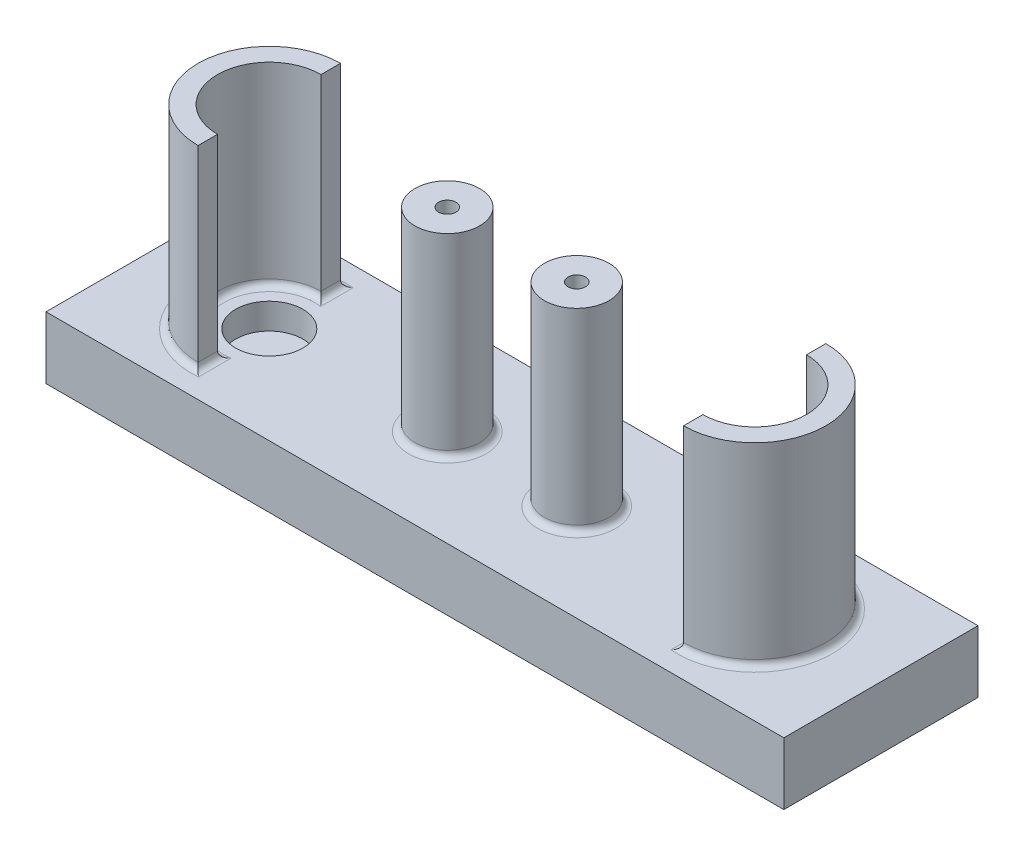
from build123d import *

# Parameters (mm, degrees)
SKETCH1_W           = 144.78
SKETCH1_H           = 38.1
SKETCH1_R           = 1.7
BOSS_EXTRUDE1_DEPTH = 12.7
SKETCH2_R           = 6.6
CUT_EXTRUDE1_DEPTH  = 5.08
SKETCH4_R           = 6.35
SKETCH4_R_2         = 1.7
BOSS_EXTRUDE2_DEPTH = 38.1
FILLET1_R           = 1.27
CHAMFER1_SIZE       = 0.5


with BuildPart() as part:
    # Sketch1 → Boss-Extrude1 (new body)
    with BuildSketch(Plane(origin=(0, 0, 0), x_dir=(1, 0, 0), z_dir=(0, 1, 0))):
        with Locations((72.39, 19.05)):
            Rectangle(SKETCH1_W, SKETCH1_H)
        with Locations(Location((59.69, 19.05, 0), (0, 0, 270))):
            Circle(SKETCH1_R, mode=Mode.SUBTRACT)
        with Locations(Location((85.09, 19.05, 0), (0, 0, 270))):
            Circle(SKETCH1_R, mode=Mode.SUBTRACT)
    extrude(amount=BOSS_EXTRUDE1_DEPTH)

    # Sketch2 → Cut-Extrude1 (cut)
    with BuildSketch(Plane(origin=(0, 12.7, 0), x_dir=(1, 0, 0), z_dir=(0, 1, 0))):
        with Locations(Location((24.765, 19.05, 0), (0, 0, 270))):
            Circle(SKETCH2_R)
        with Locations(Location((120.015, 19.05, 0), (0, 0, 90))):
            Circle(SKETCH2_R)
    extrude(amount=-CUT_EXTRUDE1_DEPTH, mode=Mode.SUBTRACT)

    # Sketch4 → Boss-Extrude2 (add)
    # profile 1 of 4: a face of its own
    with BuildSketch(Plane(origin=(0, 12.7, 0), x_dir=(1, 0, 0), z_dir=(0, 1, 0))):
        with Locations(Location((85.09, 19.05, 0), (0, 0, 90))):
            Circle(SKETCH4_R)
        with Locations(Location((85.09, 19.05, 0), (0, 0, 270))):
            Circle(SKETCH4_R_2, mode=Mode.SUBTRACT)
    # profile 2 of 4: a face of its own
    with BuildSketch(Plane(origin=(0, 12.7, 0), x_dir=(1, 0, 0), z_dir=(0, 1, 0))):
        with Locations(Location((59.69, 19.05, 0), (0, 0, 90))):
            Circle(SKETCH4_R)
        with Locations(Location((59.69, 19.05, 0), (0, 0, 270))):
            Circle(SKETCH4_R_2, mode=Mode.SUBTRACT)
    # profile 3 of 4: a face of its own
    with BuildSketch(Plane(origin=(0, 12.7, 0), x_dir=(1, 0, 0), z_dir=(0, 1, 0))):
        with BuildLine():
            Line((24.765, 33.02), (24.765, 29.21))
            ThreePointArc((24.765, 29.21), (14.605, 19.05), (24.765, 8.89))
            Line((24.765, 8.89), (24.765, 5.08))
            ThreePointArc((24.765, 5.08), (10.795, 19.05), (24.765, 33.02))
        make_face()
    # profile 4 of 4: a face of its own
    with BuildSketch(Plane(origin=(0, 12.7, 0), x_dir=(1, 0, 0), z_dir=(0, 1, 0))):
        with BuildLine():
            Line((120.015, 8.89), (120.015, 5.08))
            ThreePointArc((120.015, 5.08), (133.985, 19.05), (120.015, 33.02))
            Line((120.015, 33.02), (120.015, 29.21))
            ThreePointArc((120.015, 29.21), (130.175, 19.05), (120.015, 8.89))
        make_face()
    extrude(amount=BOSS_EXTRUDE2_DEPTH)

    # Fillet1
    fillet1_edges = [part.edges().sort_by_distance(p)[0] for p in [
        (85.09, 12.7, -12.7),
        (59.69, 12.7, -12.7),
        (14.605, 12.7, -19.05),
        (24.765, 12.7, -31.115),
        (10.795, 12.7, -19.05),
        (24.765, 12.7, -6.985),
        (130.175, 12.7, -19.05),
        (120.015, 12.7, -6.985),
        (133.985, 12.7, -19.05),
        (120.015, 12.7, -31.115),
    ]]
    fillet(fillet1_edges, radius=FILLET1_R)

    # Chamfer1
    chamfer1_edges = [part.edges().sort_by_distance(p)[0] for p in [
        (59.69, 0, -20.75),
        (85.09, 0, -20.75),
        (72.39, 0, -38.1),
        (144.78, 0, -19.05),
        (72.39, 0, 0),
        (0, 0, -19.05),
    ]]
    chamfer(chamfer1_edges, length=CHAMFER1_SIZE)


solid = part.part
